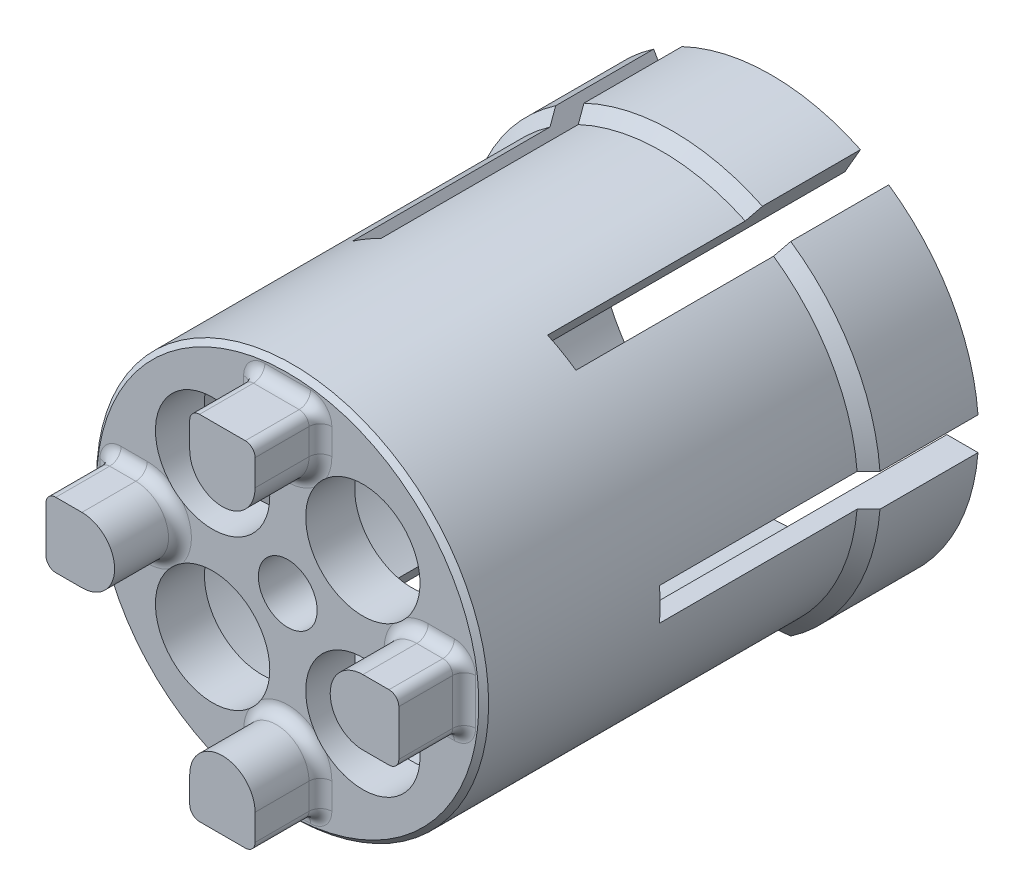
from build123d import *

# Parameters (mm, degrees)
CUT_EXTRUDE8_DEPTH       = 0.508
FILLET1_R                = 0.0889
CIRPATTERN4_COUNT        = 4
FILLET1_OF_CIRPATTERN4_R = 0.0889
SKETCH20_R               = 0.4445
CUT_EXTRUDE13_DEPTH      = 1.27
CIRPATTERN7_COUNT        = 4
SKETCH15_W               = 2.8956
SKETCH15_H               = 2.041628117
CUT_EXTRUDE11_DEPTH      = 0.127
CIRPATTERN8_COUNT        = 6
SKETCH17_R               = 0.2286
CUT_EXTRUDE12_DEPTH      = 2.54
CHAMFER1_SIZE            = 0.0381


with BuildPart() as part:
    # Sketch5 → Revolve1 (revolve)
    with BuildSketch(Plane(origin=(0, 0, 0), x_dir=(0, 0, -1), z_dir=(1, 0, 0)), mode=Mode.PRIVATE) as revolve1_sk:
        Polygon((20.6248, 1.3716), (17.2466, 1.3716), (17.2466, 0), (16.8656, 0), (16.3576, 0), (16.3576, 1.524), (16.8656, 1.524), (19.7739, 1.524), (19.8628, 1.6129), (20.6248, 1.6129), align=None)
    revolve(revolve1_sk.sketch.rotate(Axis((0, 0, -21.245346815), (0, 0, -1)), 90), axis=Axis((0, 0, -21.245346815), (0, 0, -1)))

    # Sketch11 → Cut-Extrude8 (cut)
    with BuildSketch(Plane.XY.offset(-16.3576)):
        Polygon((-0.143684098, 0), (1.79361035, -1.937294448), (1.79361035, 1.937294448), align=None)
        with BuildLine():
            Line((1.2954, 0.254), (1.0922, 0.254))
            ThreePointArc((1.0922, 0.254), (0.8382, 0), (1.0922, -0.254))
            Line((1.0922, -0.254), (1.2954, -0.254))
            ThreePointArc((1.2954, -0.254), (1.349281537, -0.231681537), (1.3716, -0.1778))
            Line((1.3716, -0.1778), (1.3716, 0.1778))
            ThreePointArc((1.3716, 0.1778), (1.349281537, 0.231681537), (1.2954, 0.254))
        make_face(mode=Mode.SUBTRACT)
    cut_extrude8 = extrude(amount=-CUT_EXTRUDE8_DEPTH, mode=Mode.SUBTRACT)

    # Fillet1
    fillet1_edges = [part.edges().sort_by_distance(p)[0] for p in [
        (1.349281537, 0.231681537, -16.8656),
        (1.1938, 0.254, -16.8656),
        (0.8382, 0, -16.8656),
        (1.1938, -0.254, -16.8656),
        (1.349281537, -0.231681537, -16.8656),
        (1.3716, 0, -16.8656),
    ]]
    fillet(fillet1_edges, radius=FILLET1_R)

    # CirPattern4: Cut-Extrude8 ×4 about axis
    cirpattern4_axis = Axis((0, 0, 0), (0, 0, 1))
    for i in range(1, CIRPATTERN4_COUNT):
        add(cut_extrude8.rotate(cirpattern4_axis, i * 360 / CIRPATTERN4_COUNT), mode=Mode.SUBTRACT)

    # Fillet1 of CirPattern4
    fillet1_of_cirpattern4_edges = [part.edges().sort_by_distance(p)[0] for p in [
        (-0.231681537, 1.349281537, -16.8656),
        (-0.254, 1.1938, -16.8656),
        (0, 0.8382, -16.8656),
        (0.254, 1.1938, -16.8656),
        (0.231681537, 1.349281537, -16.8656),
        (0, 1.3716, -16.8656),
        (-1.349281537, -0.231681537, -16.8656),
        (-1.1938, -0.254, -16.8656),
        (-0.8382, 0, -16.8656),
        (-1.1938, 0.254, -16.8656),
        (-1.349281537, 0.231681537, -16.8656),
        (-1.3716, 0, -16.8656),
        (0.231681537, -1.349281537, -16.8656),
        (0.254, -1.1938, -16.8656),
        (0, -0.8382, -16.8656),
        (-0.254, -1.1938, -16.8656),
        (-0.231681537, -1.349281537, -16.8656),
        (0, -1.3716, -16.8656),
    ]]
    fillet(fillet1_of_cirpattern4_edges, radius=FILLET1_OF_CIRPATTERN4_R)

    # Sketch20 → Cut-Extrude13 (cut, symmetric)
    with BuildSketch(Plane.XY.offset(-16.8656)):
        with Locations((0.5842, 0.5842)):
            Circle(SKETCH20_R)
    cut_extrude13 = extrude(amount=CUT_EXTRUDE13_DEPTH, both=True, mode=Mode.SUBTRACT)

    # CirPattern7: Cut-Extrude13 ×4 about axis
    cirpattern7_axis = Axis((0, 0, 0), (0, 0, 1))
    for i in range(1, CIRPATTERN7_COUNT):
        add(cut_extrude13.rotate(cirpattern7_axis, i * 360 / CIRPATTERN7_COUNT), mode=Mode.SUBTRACT)

    # Sketch15 → Cut-Extrude11 (cut, symmetric)
    with BuildSketch(Plane(origin=(0, 0, 0), x_dir=(0, 0, -1), z_dir=(0, 1, 0))):
        with Locations((19.685, 1.528814059)):
            Rectangle(SKETCH15_W, SKETCH15_H)
    cut_extrude11 = extrude(amount=CUT_EXTRUDE11_DEPTH, both=True, mode=Mode.SUBTRACT)

    # CirPattern8: Cut-Extrude11 ×6 about axis
    cirpattern8_axis = Axis((0, 0, 0), (0, 0, 1))
    for i in range(1, CIRPATTERN8_COUNT):
        add(cut_extrude11.rotate(cirpattern8_axis, i * 360 / CIRPATTERN8_COUNT), mode=Mode.SUBTRACT)

    # Sketch17 → Cut-Extrude12 (cut)
    with BuildSketch(Plane.XY.offset(-16.8656)):
        Circle(SKETCH17_R)
    extrude(amount=-CUT_EXTRUDE12_DEPTH, mode=Mode.SUBTRACT)

    # Chamfer1
    chamfer1_edges = [part.edges().sort_by_distance(p)[0] for p in [
        (-1.524, 0, -16.8656),
    ]]
    chamfer(chamfer1_edges, length=CHAMFER1_SIZE)


solid = part.part
